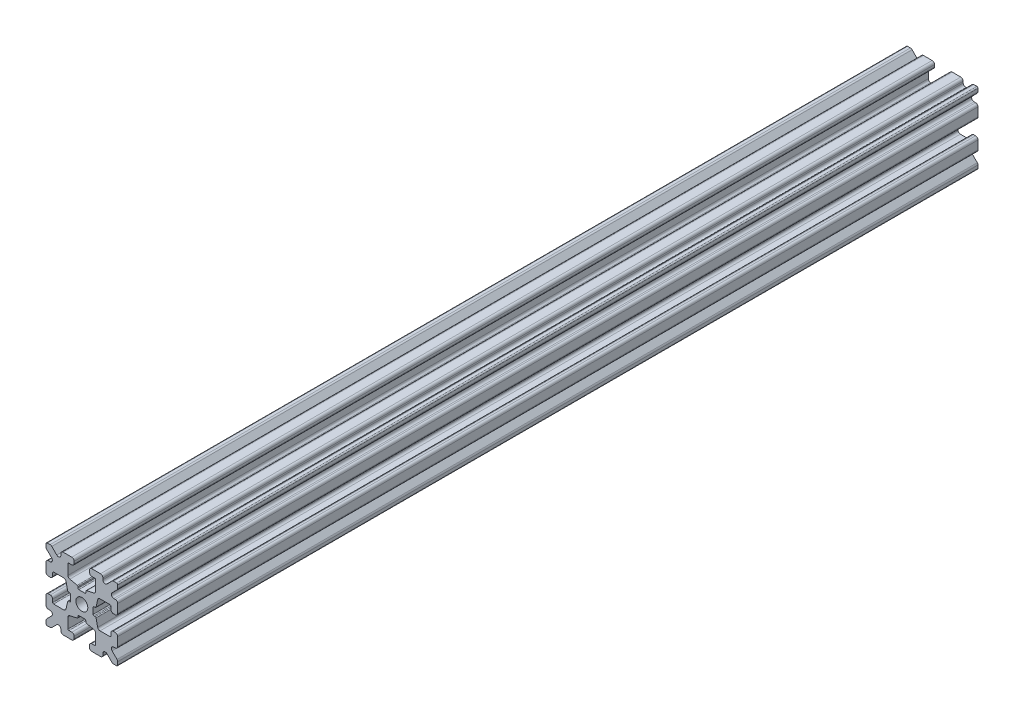
from build123d import *

# Parameters (mm, degrees)
SKETCH1_W           = 15
SKETCH1_H           = 15
SKETCH1_R           = 1.25
BOSS_EXTRUDE1_DEPTH = 90
FILLET1_R           = 0.25
CUT_EXTRUDE1_DEPTH  = 181.312229203
CUT_EXTRUDE3_DEPTH  = 181.312229203
FILLET3_R           = 0.5
FILLET4_R           = 0.5
FILLET5_R           = 3
FILLET6_R           = 0.2
CUT_EXTRUDE4_DEPTH  = 181.312229203
FILLET8_R           = 0.5
SKETCH6_W           = 5.1529354
SKETCH6_H           = 1.651
SKETCH6_W_2         = 1.651
SKETCH6_H_2         = 5.1529354
CUT_EXTRUDE5_DEPTH  = 181.312229203
FILLET10_R          = 0.2


with BuildPart() as part:
    # Sketch1 → Boss-Extrude1 (new, symmetric)
    with BuildSketch(Plane.XY):
        Rectangle(SKETCH1_W, SKETCH1_H)
        with Locations(Location((0, 0, 0), (0, 0, 180))):
            Circle(SKETCH1_R, mode=Mode.SUBTRACT)
    extrude(amount=BOSS_EXTRUDE1_DEPTH, both=True)

    # Fillet1
    fillet1_edges = [part.edges().sort_by_distance(p)[0] for p in [
        (7.5, -7.5, 0),
        (-7.5, -7.5, 0),
        (-7.5, 7.5, 0),
        (7.5, 7.5, 0),
    ]]
    fillet(fillet1_edges, radius=FILLET1_R)

    # Sketch2 → Cut-Extrude1 (cut, through all)
    with BuildSketch(Plane.XY.offset(90)):
        Polygon((-7.5, 1.6), (-6.1, 1.6), (-6.1, 2.9), (-3.4, 2.9), (-3.4, -2.9), (-6.1, -2.9), (-6.1, -1.6), (-7.5, -1.6), align=None)
        Polygon((2.9, 6.1), (1.6, 6.1), (1.6, 7.5), (-1.6, 7.5), (-1.6, 6.1), (-2.9, 6.1), (-2.9, 3.4), (2.9, 3.4), align=None)
        Polygon((-1.6, -7.5), (-1.6, -6.1), (-2.9, -6.1), (-2.9, -3.4), (2.9, -3.4), (2.9, -6.1), (1.6, -6.1), (1.6, -7.5), align=None)
        Polygon((6.1, -2.9), (6.1, -1.6), (7.5, -1.6), (7.5, 1.6), (6.1, 1.6), (6.1, 2.9), (3.4, 2.9), (3.4, -2.9), align=None)
    extrude(amount=-CUT_EXTRUDE1_DEPTH, mode=Mode.SUBTRACT)

    # Sketch4 → Cut-Extrude3 (cut, through all)
    with BuildSketch(Plane.XY.offset(90)):
        Polygon((-3.4, 2.9), (-2.75, 0), (-3.4, -2.9), align=None)
        Polygon((-2.9, 3.4), (0, 2.75), (2.9, 3.4), align=None)
        Polygon((3.4, 2.9), (2.75, 0), (3.4, -2.9), align=None)
        Polygon((-2.9, -3.4), (0, -2.75), (2.9, -3.4), align=None)
    extrude(amount=-CUT_EXTRUDE3_DEPTH, mode=Mode.SUBTRACT)

    # Fillet3
    fillet3_edges = [part.edges().sort_by_distance(p)[0] for p in [
        (1.6, -7.5, 0),
        (-1.6, -7.5, 0),
        (-1.6, -6.1, 0),
        (1.6, -6.1, 0),
        (6.1, 1.6, 0),
        (7.5, 1.6, 0),
        (7.5, -1.6, 0),
        (6.1, -1.6, 0),
        (-7.5, -1.6, 0),
        (-7.5, 1.6, 0),
        (-6.1, 1.6, 0),
        (-6.1, -1.6, 0),
        (-1.6, 6.1, 0),
        (-1.6, 7.5, 0),
        (1.6, 7.5, 0),
        (1.6, 6.1, 0),
    ]]
    fillet(fillet3_edges, radius=FILLET3_R)

    # Fillet4
    fillet4_edges = [part.edges().sort_by_distance(p)[0] for p in [
        (-2.9, -3.4, 0),
        (2.9, -3.4, 0),
        (3.4, -2.9, 0),
        (3.4, 2.9, 0),
        (-3.4, 2.9, 0),
        (-3.4, -2.9, 0),
        (2.9, 3.4, 0),
        (-2.9, 3.4, 0),
    ]]
    fillet(fillet4_edges, radius=FILLET4_R)

    # Fillet5
    fillet5_edges = [part.edges().sort_by_distance(p)[0] for p in [
        (-2.75, 0, 0),
        (0, 2.75, 0),
        (2.75, 0, 0),
        (0, -2.75, 0),
    ]]
    fillet(fillet5_edges, radius=FILLET5_R)

    # Fillet6
    fillet6_edges = [part.edges().sort_by_distance(p)[0] for p in [
        (-2.9, -6.1, 0),
        (2.9, -6.1, 0),
        (6.1, -2.9, 0),
        (6.1, 2.9, 0),
        (-6.1, 2.9, 0),
        (-6.1, -2.9, 0),
        (2.9, 6.1, 0),
        (-2.9, 6.1, 0),
    ]]
    fillet(fillet6_edges, radius=FILLET6_R)

    # Sketch5 → Cut-Extrude4 (cut, through all)
    with BuildSketch(Plane.XY.offset(90)):
        Polygon((-7.5, 6.439339828), (-5.460660172, 4.4), (-7.5, 4.4), align=None)
        Polygon((-6.439339828, 7.5), (-4.4, 5.460660172), (-4.4, 7.5), align=None)
        Polygon((4.4, 7.5), (6.439339828, 7.5), (4.4, 5.460660172), align=None)
        Polygon((7.5, 6.439339828), (7.5, 4.4), (5.460660172, 4.4), align=None)
        Polygon((7.5, -6.439339828), (5.460660172, -4.4), (7.5, -4.4), align=None)
        Polygon((6.439339828, -7.5), (4.4, -5.460660172), (4.4, -7.5), align=None)
        Polygon((-4.4, -7.5), (-6.439339828, -7.5), (-4.4, -5.460660172), align=None)
        Polygon((-7.5, -6.439339828), (-7.5, -4.4), (-5.460660172, -4.4), align=None)
    extrude(amount=-CUT_EXTRUDE4_DEPTH, mode=Mode.SUBTRACT)

    # Fillet8
    fillet8_edges = [part.edges().sort_by_distance(p)[0] for p in [
        (-7.5, 4.4, 0),
        (-7.5, 6.439339828, 0),
        (-5.460660172, 4.4, 0),
        (7.5, -4.4, 0),
        (7.5, -6.439339828, 0),
        (5.460660172, -4.4, 0),
        (5.460660172, 4.4, 0),
        (7.5, 6.439339828, 0),
        (7.5, 4.4, 0),
        (-4.4, 7.5, 0),
        (-4.4, 5.460660172, 0),
        (-6.439339828, 7.5, 0),
        (-5.460660172, -4.4, 0),
        (-7.5, -6.439339828, 0),
        (-7.5, -4.4, 0),
        (4.4, 5.460660172, 0),
        (4.4, 7.5, 0),
        (6.439339828, 7.5, 0),
        (6.439339828, -7.5, 0),
        (4.4, -7.5, 0),
        (4.4, -5.460660172, 0),
        (-6.439339828, -7.5, 0),
        (-4.4, -5.460660172, 0),
        (-4.4, -7.5, 0),
    ]]
    fillet(fillet8_edges, radius=FILLET8_R)

    # Sketch6 → Cut-Extrude5 (cut, through all)
    with BuildSketch(Plane.XY.offset(90)):
        with Locations((4.9235323, 0)):
            Rectangle(SKETCH6_W, SKETCH6_H)
        with Locations((0, -4.9235323)):
            Rectangle(SKETCH6_W_2, SKETCH6_H_2)
        with Locations((-4.9235323, 0)):
            Rectangle(SKETCH6_W, SKETCH6_H)
        with Locations((0, 4.9235323)):
            Rectangle(SKETCH6_W_2, SKETCH6_H_2)
    extrude(amount=-CUT_EXTRUDE5_DEPTH, mode=Mode.SUBTRACT)

    # Fillet10
    fillet10_edges = [part.edges().sort_by_distance(p)[0] for p in [
        (0.8255, -2.935025862, 0),
        (-0.8255, -2.935025862, 0),
        (0.8255, -2.3470646, 0),
        (-0.8255, -2.3470646, 0),
        (2.935025862, 0.8255, 0),
        (2.935025862, -0.8255, 0),
        (2.3470646, 0.8255, 0),
        (2.3470646, -0.8255, 0),
        (-2.935025862, -0.8255, 0),
        (-2.935025862, 0.8255, 0),
        (-2.3470646, -0.8255, 0),
        (-2.3470646, 0.8255, 0),
        (-0.8255, 2.935025862, 0),
        (0.8255, 2.935025862, 0),
        (-0.8255, 2.3470646, 0),
        (0.8255, 2.3470646, 0),
    ]]
    fillet(fillet10_edges, radius=FILLET10_R)


solid = part.part
